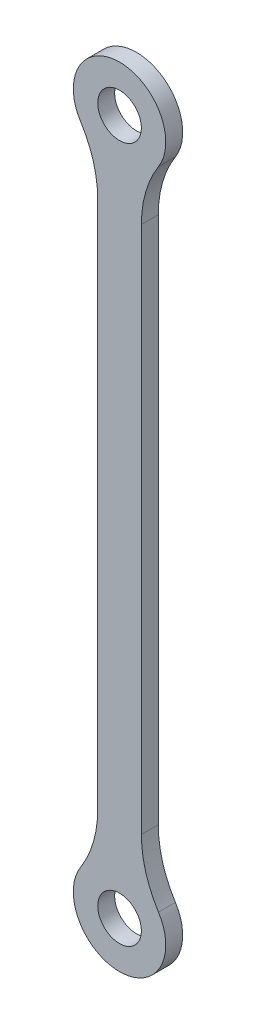
from build123d import *

# Parameters (mm, degrees)
SKETCH1_R           = 8
BOSS_EXTRUDE1_DEPTH = 6.2


with BuildPart() as part:
    # Sketch1 → Boss-Extrude1 (new body)
    with BuildSketch(Plane.XY):
        with BuildLine():
            Line((-8, 96.851957648), (-8, -96.851957648))
            ThreePointArc((-8, -96.851957648), (-9.603702256, -108.064643302), (-14.286215979, -118.378238492))
            ThreePointArc((-14.286215979, -118.378238492), (0, -144.45), (14.286215979, -118.378238492))
            ThreePointArc((14.286215979, -118.378238492), (9.603702256, -108.064643302), (8, -96.851957648))
            Line((8, -96.851957648), (8, 96.851957648))
            ThreePointArc((8, 96.851957648), (9.603702256, 108.064643302), (14.286215979, 118.378238492))
            ThreePointArc((14.286215979, 118.378238492), (0, 144.45), (-14.286215979, 118.378238492))
            ThreePointArc((-14.286215979, 118.378238492), (-9.603702256, 108.064643302), (-8, 96.851957648))
        make_face()
        with Locations(Location((0, 127.5, 0), (0, 0, 180))):
            Circle(SKETCH1_R, mode=Mode.SUBTRACT)
        with Locations(Location((0, -127.5, 0), (0, 0, 180))):
            Circle(SKETCH1_R, mode=Mode.SUBTRACT)
    extrude(amount=BOSS_EXTRUDE1_DEPTH)


solid = part.part
